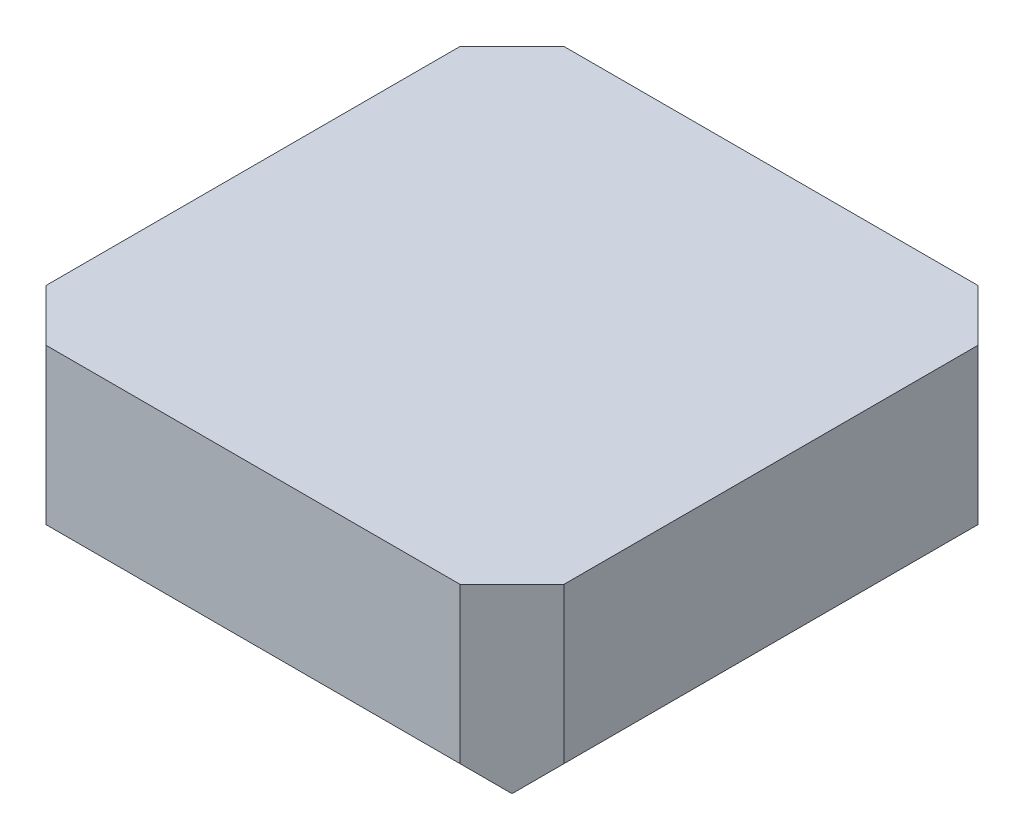
from build123d import *

# Parameters (mm, degrees)
ESQUISSE1_W        = 10
ESQUISSE1_H        = 10
BOSS_EXTRU_1_DEPTH = 6
CHANFREIN1_SIZE    = 3
CHANFREIN2_SIZE    = 1


with BuildPart() as part:
    # Esquisse1 → Boss.-Extru.1 (new body)
    with BuildSketch(Plane(origin=(0, 0, 0), x_dir=(1, 0, 0), z_dir=(0, 1, 0))):
        Rectangle(ESQUISSE1_W, ESQUISSE1_H)
    extrude(amount=BOSS_EXTRU_1_DEPTH)

    # Chanfrein1
    chanfrein1_edges = [part.edges().sort_by_distance(p)[0] for p in [
        (0, 0, 5),
        (-5, 0, 0),
        (0, 0, -5),
        (5, 0, 0),
    ]]
    chamfer(chanfrein1_edges, length=CHANFREIN1_SIZE)

    # Chanfrein2
    chanfrein2_edges = [part.edges().sort_by_distance(p)[0] for p in [
        (5, 4.5, 5),
        (-5, 4.5, 5),
        (-5, 4.5, -5),
        (5, 4.5, -5),
    ]]
    chamfer(chanfrein2_edges, length=CHANFREIN2_SIZE)


solid = part.part
